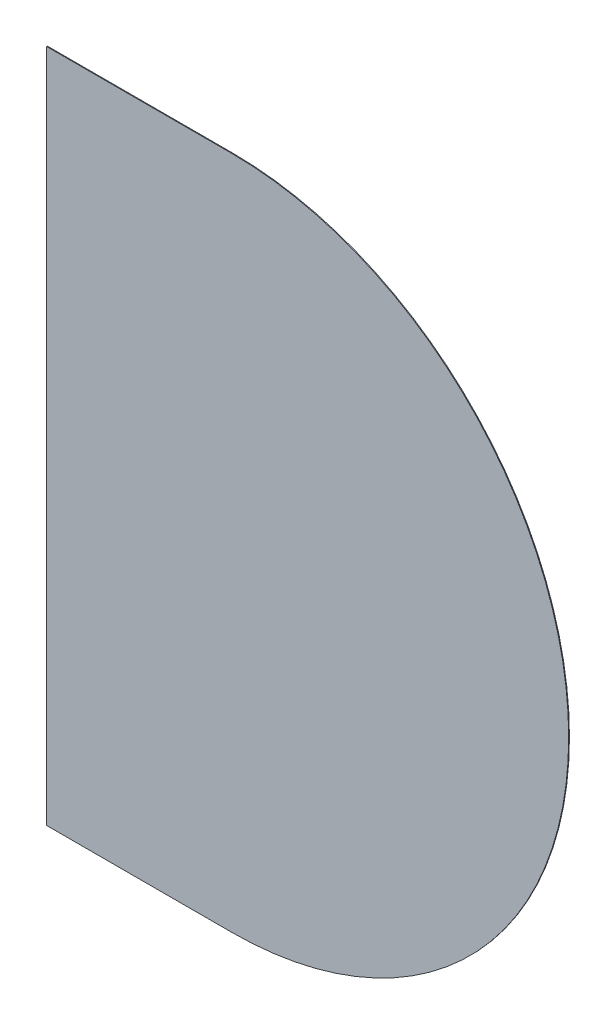
from build123d import *

# Parameters (mm, degrees)
BOSS_EXTRUDE1_DEPTH = 2


with BuildPart() as part:
    # Sketch1 → Boss-Extrude1 (new body)
    with BuildSketch(Plane.XY):
        with BuildLine():
            Line((0, 0), (485, 0))
            ThreePointArc((485, 0), (1370, 885), (485, 1770))
            Line((485, 1770), (0, 1770))
            Line((0, 1770), (0, 0))
        make_face()
    extrude(amount=BOSS_EXTRUDE1_DEPTH)


solid = part.part
